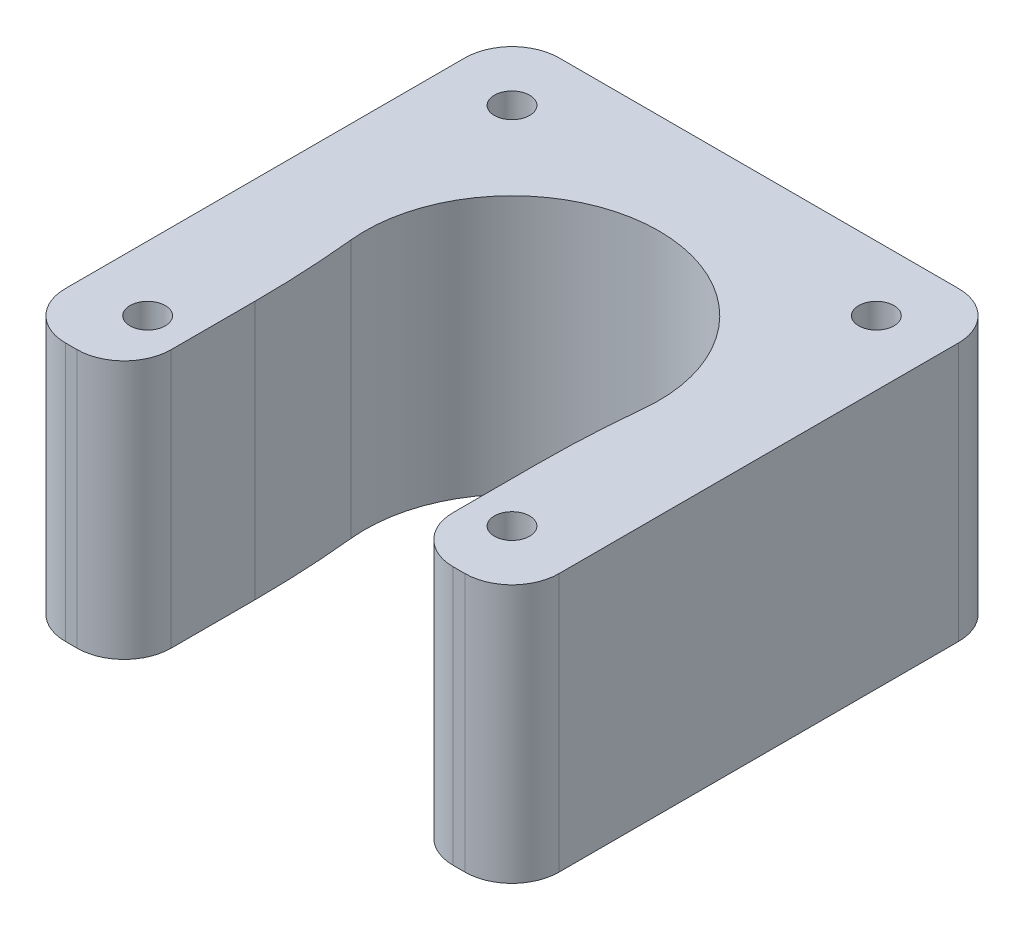
from build123d import *

# Parameters (mm, degrees)
BOSS_EXTRUDE1_DEPTH = 22
FILLET1_R           = 85
FILLET2_R           = 4


with BuildPart() as part:
    # Sketch1 → Boss-Extrude1 (new body)
    with BuildSketch(Plane(origin=(0, 0, 0), x_dir=(1, 0, 0), z_dir=(0, 1, 0))):
        with BuildLine():
            Line((-12, -21), (-12, -15.5))
            Line((-12, -15.5), (-14, -15.5))
            ThreePointArc((-14, -15.5), (-16.560660172, -16.560660172), (-15.5, -14))
            Line((-15.5, -14), (-15.5, 14))
            ThreePointArc((-15.5, 14), (-16.560660172, 16.560660172), (-14, 15.5))
            Line((-14, 15.5), (14, 15.5))
            ThreePointArc((14, 15.5), (15.5, 17), (17, 15.5))
            ThreePointArc((17, 15.5), (16.560660172, 14.439339828), (15.5, 14))
            Line((15.5, 14), (15.5, -14))
            ThreePointArc((15.5, -14), (16.560660172, -14.439339828), (17, -15.5))
            ThreePointArc((17, -15.5), (15.5, -17), (14, -15.5))
            Line((14, -15.5), (12, -15.5))
            Line((12, -15.5), (12, -21))
            Line((12, -21), (21, -21))
            Line((21, -21), (21, 21))
            Line((21, 21), (-21, 21))
            Line((-21, 21), (-21, -21))
            Line((-21, -21), (-12, -21))
        make_face()
        with BuildLine():
            Line((-12, -15.5), (-12, -3.5))
            ThreePointArc((-12, -3.5), (-1.767766953, 12.374368671), (12.5, 0))
            ThreePointArc((12.5, 0), (12.374368671, -1.767766953), (12, -3.5))
            Line((12, -3.5), (12, -15.5))
            Line((12, -15.5), (14, -15.5))
            ThreePointArc((14, -15.5), (14.439339828, -14.439339828), (15.5, -14))
            Line((15.5, -14), (15.5, 14))
            ThreePointArc((15.5, 14), (14.439339828, 14.439339828), (14, 15.5))
            Line((14, 15.5), (-14, 15.5))
            ThreePointArc((-14, 15.5), (-14.439339828, 14.439339828), (-15.5, 14))
            Line((-15.5, 14), (-15.5, -14))
            ThreePointArc((-15.5, -14), (-14.439339828, -14.439339828), (-14, -15.5))
            Line((-14, -15.5), (-12, -15.5))
        make_face()
    extrude(amount=BOSS_EXTRUDE1_DEPTH)

    # Fillet1
    fillet1_edges = [part.edges().sort_by_distance(p)[0] for p in [
        (-12, 11, 3.5),
        (12, 11, 3.5),
    ]]
    fillet(fillet1_edges, radius=FILLET1_R)

    # Fillet2
    fillet2_edges = [part.edges().sort_by_distance(p)[0] for p in [
        (-12, 11, 21),
        (-21, 11, 21),
        (-21, 11, -21),
        (21, 11, -21),
        (21, 11, 21),
        (12, 11, 21),
    ]]
    fillet(fillet2_edges, radius=FILLET2_R)


solid = part.part
